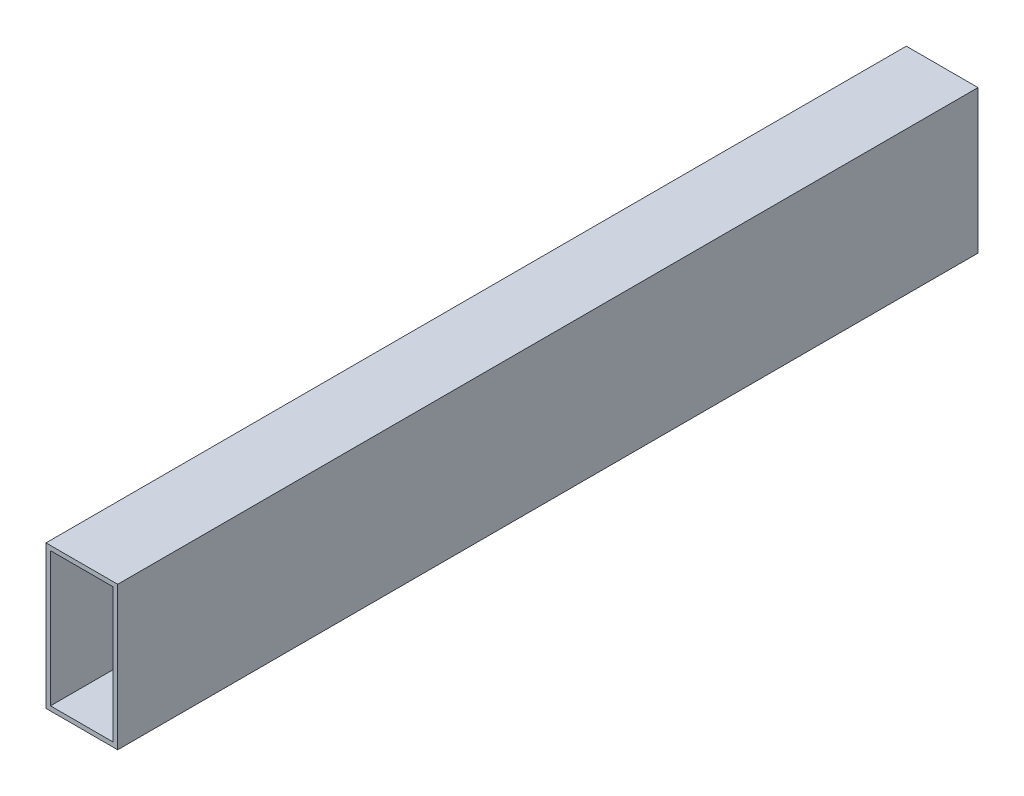
from build123d import *

# Parameters (mm, degrees)
SKETCH1_W           = 25.4
SKETCH1_H           = 50.8
SKETCH1_W_2         = 22.225
SKETCH1_H_2         = 47.625
EXTRUDE_THIN1_DEPTH = 304.8


with BuildPart() as part:
    # Sketch1 → Extrude-Thin1 (new body)
    with BuildSketch(Plane.XY):
        with Locations((12.7, 25.4)):
            Rectangle(SKETCH1_W, SKETCH1_H)
        with Locations((12.7, 25.4)):
            Rectangle(SKETCH1_W_2, SKETCH1_H_2, mode=Mode.SUBTRACT)
    extrude(amount=EXTRUDE_THIN1_DEPTH)


solid = part.part
